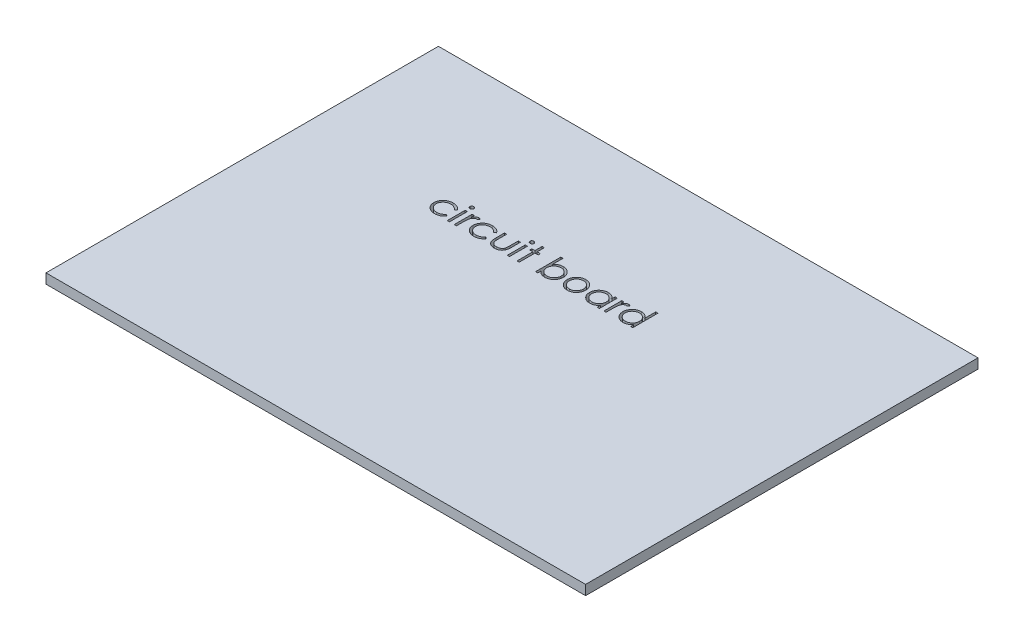
from build123d import *

# Parameters (mm, degrees)
SKETCH1_W           = 69.85
SKETCH1_H           = 50.8
BOSS_EXTRUDE1_DEPTH = 1.27
SKETCH2_W           = 0.284935898
SKETCH2_H           = 2.320192307
SKETCH2_W_2         = 0.284935897
CUT_EXTRUDE1_DEPTH  = 87.378674452


with BuildPart() as part:
    # Sketch1 → Boss-Extrude1 (new body)
    with BuildSketch(Plane(origin=(0, 0, 0), x_dir=(1, 0, 0), z_dir=(0, 1, 0))):
        with Locations((34.925, 25.4)):
            Rectangle(SKETCH1_W, SKETCH1_H)
    extrude(amount=BOSS_EXTRUDE1_DEPTH)

    # Sketch2 → Cut-Extrude1 (cut, through all)
    # profile 1 of 14: a face of its own
    with BuildSketch(Plane(origin=(0, 1.27, 0), x_dir=(1, 0, 0), z_dir=(0, 1, 0))):
        with BuildLine():
            Line((19.584512115, 33.646399985), (19.346005504, 33.498207878))
            add(Edge.make_bspline(
                [(19.346005504, 33.498207878), (19.319852698, 33.53070935), (19.268375338, 33.594682978), (19.178986174, 33.677241989), (19.08372582, 33.748150663), (18.980966448, 33.805939065), (18.870852186, 33.850589953), (18.753817286, 33.882185925), (18.629878435, 33.901874774), (18.544910719, 33.904112547), (18.501374094, 33.90525916)],
                knots=[0, 0, 0, 0, 1.026593902, 2.0206758, 2.988051866, 3.946915611, 4.916868779, 5.907761954, 6.927957743, 8, 8, 8, 8], degree=3))
            add(Edge.make_bspline(
                [(18.501374094, 33.90525916), (18.46657704, 33.904300453), (18.398045189, 33.902412306), (18.297437464, 33.89060993), (18.201604758, 33.869163251), (18.109946401, 33.840904883), (18.023114307, 33.803031406), (17.940880973, 33.756939699), (17.862516993, 33.703372876), (17.790293235, 33.641314739), (17.724226921, 33.573824519), (17.666987192, 33.501476524), (17.617151546, 33.426437765), (17.578048285, 33.346834399), (17.546048666, 33.264487551), (17.524996856, 33.177842839), (17.510968168, 33.088010289), (17.509363134, 33.026761509), (17.508550576, 32.995753952)],
                knots=[0, 0, 0, 0, 1.112346261, 2.190735716, 3.231507886, 4.247384806, 5.251966152, 6.253067467, 7.256802811, 8.280671706, 9.291813951, 10.270744147, 11.225547591, 12.165006084, 13.100104208, 14.043489273, 15.009504848, 16, 16, 16, 16], degree=3))
            add(Edge.make_bspline(
                [(17.508550576, 32.995753952), (17.510164612, 32.955141882), (17.513370936, 32.874464954), (17.538500118, 32.755376962), (17.579633973, 32.640239043), (17.635929309, 32.529868661), (17.707119281, 32.427729677), (17.790732963, 32.336123258), (17.886816703, 32.256824433), (17.994523889, 32.191081499), (18.111325556, 32.138230116), (18.235958008, 32.100577035), (18.367402809, 32.077850954), (18.457397501, 32.074988063), (18.503282147, 32.073528391)],
                knots=[0, 0, 0, 0, 0.966302908, 1.919585723, 2.883856336, 3.870342332, 4.860282998, 5.839159637, 6.814385684, 7.815993281, 8.834850808, 9.858348828, 10.908058873, 12, 12, 12, 12], degree=3))
            add(Edge.make_bspline(
                [(18.503282147, 32.073528391), (18.545332921, 32.07470722), (18.627973852, 32.077023933), (18.748775603, 32.096553779), (18.863783094, 32.128524789), (18.972992236, 32.173108729), (19.076203472, 32.230737261), (19.172749938, 32.301820223), (19.264552739, 32.384312711), (19.318524996, 32.448101156), (19.346005504, 32.480579673)],
                knots=[0, 0, 0, 0, 1.039848629, 2.043578496, 3.018386758, 3.987534228, 4.954977003, 5.934852016, 6.948509513, 8, 8, 8, 8], degree=3))
            Line((19.346005504, 32.480579673), (19.584512115, 32.324119336))
            add(Edge.make_bspline(
                [(19.584512115, 32.324119336), (19.570371842, 32.303354177), (19.54213823, 32.26189278), (19.494941741, 32.20343276), (19.444033037, 32.148712377), (19.389610727, 32.09780498), (19.332385426, 32.049492349), (19.27040225, 32.006084134), (19.205659817, 31.965140402), (19.137398081, 31.928298726), (19.066322805, 31.895182277), (18.992534, 31.866706), (18.916352313, 31.842240261), (18.837688172, 31.822793525), (18.756386493, 31.807271551), (18.672657539, 31.796972121), (18.586530147, 31.789283831), (18.528316838, 31.788824937), (18.498830023, 31.788592493)],
                knots=[0, 0, 0, 0, 0.954134338, 1.905101784, 2.851144739, 3.791306361, 4.734911809, 5.6936923, 6.663572882, 7.643865596, 8.638447847, 9.640600242, 10.646758161, 11.676244097, 12.717260333, 13.78922464, 14.880174919, 16, 16, 16, 16], degree=3))
            add(Edge.make_bspline(
                [(18.498830023, 31.788592493), (18.453825865, 31.789401012), (18.365617387, 31.790985713), (18.236510541, 31.808410544), (18.113126714, 31.834679239), (17.995508061, 31.872383483), (17.88363627, 31.920919958), (17.777615655, 31.980208016), (17.677797267, 32.050739997), (17.5851682, 32.131260509), (17.500095031, 32.218564519), (17.427046273, 32.312771231), (17.363686634, 32.410417038), (17.31280722, 32.513658537), (17.27230608, 32.621123553), (17.244633839, 32.733672985), (17.226736148, 32.850378959), (17.224664797, 32.929965216), (17.223614679, 32.970313247)],
                knots=[0, 0, 0, 0, 1.1129367, 2.181364009, 3.217532258, 4.231199276, 5.232079859, 6.230262199, 7.231623845, 8.250719726, 9.263571943, 10.242672461, 11.195837495, 12.138959767, 13.085126421, 14.0317438, 15.002148558, 16, 16, 16, 16], degree=3))
            add(Edge.make_bspline(
                [(17.223614679, 32.970313247), (17.224014744, 32.997689398), (17.224810538, 33.052145082), (17.233938144, 33.132967035), (17.245729616, 33.212712644), (17.265710106, 33.290371075), (17.288788393, 33.36712016), (17.31824834, 33.44203483), (17.352806305, 33.515463212), (17.392042, 33.587216152), (17.436209648, 33.656113234), (17.485087624, 33.721204059), (17.536834986, 33.78327056), (17.593872602, 33.840169972), (17.653780002, 33.894177802), (17.718252074, 33.943851244), (17.786919025, 33.989336286), (17.858749611, 34.031473993), (17.933702027, 34.068992909), (18.011323221, 34.101317346), (18.091145469, 34.128942183), (18.173296457, 34.150812416), (18.257230914, 34.169152508), (18.343610271, 34.180689411), (18.432104072, 34.188841244), (18.492026322, 34.189740034), (18.522362676, 34.190195058)],
                knots=[0, 0, 0, 0, 0.990994727, 1.971252077, 2.943264845, 3.907940874, 4.872158414, 5.844625996, 6.82015047, 7.809835459, 8.804511986, 9.781214284, 10.756496977, 11.728388426, 12.696359165, 13.676225489, 14.672885716, 15.677705647, 16.690706858, 17.706033469, 18.721040654, 19.747369689, 20.783475414, 21.830280724, 22.901553713, 24, 24, 24, 24], degree=3))
            add(Edge.make_bspline(
                [(18.522362676, 34.190195058), (18.560353917, 34.189358771), (18.6361465, 34.187690377), (18.748578427, 34.173649028), (18.859354353, 34.152479565), (18.966530654, 34.121117069), (19.068807849, 34.083140753), (19.164543579, 34.040493505), (19.251484245, 33.9909684), (19.331247129, 33.936793725), (19.403981405, 33.875687761), (19.470433695, 33.806920021), (19.531966691, 33.7308484), (19.566852422, 33.674781773), (19.584512115, 33.646399985)],
                knots=[0, 0, 0, 0, 1.095225653, 2.184976855, 3.262915854, 4.344593502, 5.400796181, 6.407717688, 7.363229445, 8.282371371, 9.184954523, 10.097238608, 11.036792983, 12, 12, 12, 12], degree=3))
        make_face()
    # profile 2 of 14: a face of its own
    with BuildSketch(Plane(origin=(0, 1.27, 0), x_dir=(1, 0, 0), z_dir=(0, 1, 0))):
        with BuildLine():
            add(Edge.make_bspline(
                [(20.254874695, 35.126413006), (20.272556103, 35.125592811), (20.307179695, 35.123986711), (20.357247874, 35.110233085), (20.402838163, 35.086919799), (20.443276535, 35.055641803), (20.477976461, 35.018857665), (20.502270391, 34.975985215), (20.517884493, 34.929667736), (20.51977004, 34.897359762), (20.520730063, 34.880910202)],
                knots=[0, 0, 0, 0, 1.055194115, 2.066272739, 3.074728998, 4.095836921, 5.109056067, 6.073838105, 7.019297344, 8, 8, 8, 8], degree=3))
            add(Edge.make_bspline(
                [(20.520730063, 34.880910202), (20.51974839, 34.864887652), (20.517807737, 34.833212968), (20.502282452, 34.787698461), (20.477769422, 34.745421718), (20.443298786, 34.708709002), (20.402832267, 34.677448297), (20.35724944, 34.654130427), (20.307179283, 34.640378016), (20.272555964, 34.638771749), (20.254874695, 34.637951468)],
                knots=[0, 0, 0, 0, 0.96129708, 1.900370562, 2.859976407, 3.87933698, 4.906634145, 5.921202961, 6.938410037, 8, 8, 8, 8], degree=3))
            add(Edge.make_bspline(
                [(20.254874695, 34.637951468), (20.237395617, 34.638740428), (20.203374875, 34.640276037), (20.154056382, 34.654400267), (20.108854824, 34.677456276), (20.068337585, 34.708504316), (20.034564481, 34.745647187), (20.009982429, 34.78767266), (19.994492999, 34.833219536), (19.992547515, 34.864889859), (19.991563397, 34.880910202)],
                knots=[0, 0, 0, 0, 1.054934014, 2.053291228, 3.073705704, 4.106921865, 5.123545215, 6.088680038, 7.033164197, 8, 8, 8, 8], degree=3))
            add(Edge.make_bspline(
                [(19.991563397, 34.880910202), (19.992525954, 34.897357472), (19.994416477, 34.92966095), (20.009994039, 34.976011444), (20.034359722, 35.018630378), (20.068359948, 35.055846367), (20.108848872, 35.086911868), (20.15405792, 35.109963259), (20.203374468, 35.124088688), (20.237395479, 35.125624131), (20.254874695, 35.126413006)],
                knots=[0, 0, 0, 0, 0.98631895, 1.937192651, 2.907499808, 3.917963147, 4.944918757, 5.95915025, 6.951458133, 8, 8, 8, 8], degree=3))
        make_face()
    # profile 3 of 14: a face of its own
    with BuildSketch(Plane(origin=(0, 1.27, 0), x_dir=(1, 0, 0), z_dir=(0, 1, 0))):
        with Locations((20.25614673, 32.989393776)):
            Rectangle(SKETCH2_W, SKETCH2_H)
    # profile 4 of 14: a face of its own
    with BuildSketch(Plane(origin=(0, 1.27, 0), x_dir=(1, 0, 0), z_dir=(0, 1, 0))):
        with BuildLine():
            Line((21.009191602, 34.149489929), (21.294127499, 34.149489929))
            Line((21.294127499, 34.149489929), (21.294127499, 33.807948463))
            add(Edge.make_bspline(
                [(21.294127499, 33.807948463), (21.315163016, 33.839749107), (21.355393279, 33.900567592), (21.422261436, 33.981003315), (21.490753744, 34.047601251), (21.561198092, 34.1006723), (21.634112512, 34.140417057), (21.707896746, 34.169530025), (21.783711637, 34.186745161), (21.834658525, 34.189043552), (21.860183188, 34.190195058)],
                knots=[0, 0, 0, 0, 1.2804753, 2.448899062, 3.506932113, 4.484331642, 5.4025378, 6.288909075, 7.142734305, 8, 8, 8, 8], degree=3))
            add(Edge.make_bspline(
                [(21.860183188, 34.190195058), (21.879982785, 34.18911508), (21.920721741, 34.186892956), (21.982391661, 34.171280279), (22.045931078, 34.146353787), (22.086881673, 34.122913014), (22.108230063, 34.110692854)],
                knots=[0, 0, 0, 0, 0.901110191, 1.854092781, 2.881294221, 4, 4, 4, 4], degree=3))
            Line((22.108230063, 34.110692854), (21.951769727, 33.863918014))
            add(Edge.make_bspline(
                [(21.951769727, 33.863918014), (21.938063686, 33.870032399), (21.912046997, 33.88163867), (21.873988212, 33.895374637), (21.838898714, 33.903462646), (21.816543486, 33.90468794), (21.80612169, 33.90525916)],
                knots=[0, 0, 0, 0, 1.180555205, 2.24091978, 3.179933427, 4, 4, 4, 4], degree=3))
            add(Edge.make_bspline(
                [(21.80612169, 33.90525916), (21.783256489, 33.903735126), (21.736618107, 33.900626539), (21.668142882, 33.876189192), (21.601697203, 33.836705581), (21.548927195, 33.792916787), (21.508067437, 33.750691285), (21.478911661, 33.713817377), (21.452166598, 33.672471047), (21.426612183, 33.627359119), (21.403329188, 33.57771133), (21.381598881, 33.524023701), (21.361951198, 33.466234049), (21.350747762, 33.425972762), (21.34500891, 33.405349304)],
                knots=[0, 0, 0, 0, 1.125678352, 2.296057538, 3.5422874, 4.923748041, 5.663163013, 6.437101912, 7.23742474, 8.08941207, 8.991984279, 9.93940061, 10.944477711, 12, 12, 12, 12], degree=3))
            add(Edge.make_bspline(
                [(21.34500891, 33.405349304), (21.340715953, 33.386955011), (21.33120738, 33.34621305), (21.321962199, 33.277861174), (21.312827708, 33.197103997), (21.306390061, 33.103716731), (21.300422837, 32.997932585), (21.297057262, 32.879590406), (21.294242271, 32.748568723), (21.294166917, 32.65697056), (21.294127499, 32.609055234)],
                knots=[0, 0, 0, 0, 0.566838948, 1.255505196, 2.06880316, 3.007127437, 4.065329342, 5.249902469, 6.561414163, 8, 8, 8, 8], degree=3))
            Line((21.294127499, 32.609055234), (21.294127499, 31.829297622))
            Line((21.294127499, 31.829297622), (21.009191602, 31.829297622))
            Line((21.009191602, 31.829297622), (21.009191602, 34.149489929))
        make_face()
    # profile 5 of 14: a face of its own
    with BuildSketch(Plane(origin=(0, 1.27, 0), x_dir=(1, 0, 0), z_dir=(0, 1, 0))):
        with BuildLine():
            Line((24.67265314, 33.646399985), (24.43414653, 33.498207878))
            add(Edge.make_bspline(
                [(24.43414653, 33.498207878), (24.407993723, 33.53070935), (24.356516364, 33.594682978), (24.2671272, 33.677241989), (24.171866845, 33.748150663), (24.069107474, 33.805939065), (23.958993212, 33.850589953), (23.841958311, 33.882185925), (23.71801946, 33.901874774), (23.633051744, 33.904112547), (23.58951512, 33.90525916)],
                knots=[0, 0, 0, 0, 1.026593902, 2.0206758, 2.988051866, 3.946915611, 4.916868779, 5.907761954, 6.927957743, 8, 8, 8, 8], degree=3))
            add(Edge.make_bspline(
                [(23.58951512, 33.90525916), (23.554718066, 33.904300453), (23.486186215, 33.902412306), (23.38557849, 33.89060993), (23.289745784, 33.869163251), (23.198087426, 33.840904883), (23.111255332, 33.803031406), (23.029021999, 33.756939699), (22.950658019, 33.703372876), (22.878434261, 33.641314739), (22.812367947, 33.573824519), (22.755128218, 33.501476524), (22.705292571, 33.426437765), (22.666189311, 33.346834399), (22.634189692, 33.264487551), (22.613137882, 33.177842839), (22.599109194, 33.088010289), (22.59750416, 33.026761509), (22.596691602, 32.995753952)],
                knots=[0, 0, 0, 0, 1.112346261, 2.190735716, 3.231507886, 4.247384806, 5.251966152, 6.253067467, 7.256802811, 8.280671706, 9.291813951, 10.270744147, 11.225547591, 12.165006084, 13.100104208, 14.043489273, 15.009504848, 16, 16, 16, 16], degree=3))
            add(Edge.make_bspline(
                [(22.596691602, 32.995753952), (22.598305638, 32.955141882), (22.601511962, 32.874464954), (22.626641143, 32.755376962), (22.667774999, 32.640239043), (22.724070334, 32.529868661), (22.795260306, 32.427729677), (22.878873989, 32.336123258), (22.974957729, 32.256824433), (23.082664914, 32.191081499), (23.199466582, 32.138230116), (23.324099034, 32.100577035), (23.455543835, 32.077850954), (23.545538527, 32.074988063), (23.591423172, 32.073528391)],
                knots=[0, 0, 0, 0, 0.966302908, 1.919585723, 2.883856336, 3.870342332, 4.860282998, 5.839159637, 6.814385684, 7.815993281, 8.834850808, 9.858348828, 10.908058873, 12, 12, 12, 12], degree=3))
            add(Edge.make_bspline(
                [(23.591423172, 32.073528391), (23.633473947, 32.07470722), (23.716114877, 32.077023933), (23.836916629, 32.096553779), (23.951924119, 32.128524789), (24.061133261, 32.173108729), (24.164344498, 32.230737261), (24.260890964, 32.301820223), (24.352693765, 32.384312711), (24.406666022, 32.448101156), (24.43414653, 32.480579673)],
                knots=[0, 0, 0, 0, 1.039848629, 2.043578496, 3.018386758, 3.987534228, 4.954977003, 5.934852016, 6.948509513, 8, 8, 8, 8], degree=3))
            Line((24.43414653, 32.480579673), (24.67265314, 32.324119336))
            add(Edge.make_bspline(
                [(24.67265314, 32.324119336), (24.658512868, 32.303354177), (24.630279256, 32.26189278), (24.583082767, 32.20343276), (24.532174062, 32.148712377), (24.477751753, 32.09780498), (24.420526451, 32.049492349), (24.358543276, 32.006084134), (24.293800843, 31.965140402), (24.225539107, 31.928298726), (24.154463831, 31.895182277), (24.080675026, 31.866706), (24.004493339, 31.842240261), (23.925829197, 31.822793525), (23.844527518, 31.807271551), (23.760798564, 31.796972121), (23.674671172, 31.789283831), (23.616457864, 31.788824937), (23.586971049, 31.788592493)],
                knots=[0, 0, 0, 0, 0.954134338, 1.905101784, 2.851144739, 3.791306361, 4.734911809, 5.6936923, 6.663572882, 7.643865596, 8.638447847, 9.640600242, 10.646758161, 11.676244097, 12.717260333, 13.78922464, 14.880174919, 16, 16, 16, 16], degree=3))
            add(Edge.make_bspline(
                [(23.586971049, 31.788592493), (23.54196689, 31.789401012), (23.453758412, 31.790985713), (23.324651566, 31.808410544), (23.20126774, 31.834679239), (23.083649086, 31.872383483), (22.971777295, 31.920919958), (22.865756681, 31.980208016), (22.765938293, 32.050739997), (22.673309226, 32.131260509), (22.588236057, 32.218564519), (22.515187298, 32.312771231), (22.45182766, 32.410417038), (22.400948246, 32.513658537), (22.360447105, 32.621123553), (22.332774864, 32.733672985), (22.314877174, 32.850378959), (22.312805822, 32.929965216), (22.311755705, 32.970313247)],
                knots=[0, 0, 0, 0, 1.1129367, 2.181364009, 3.217532258, 4.231199276, 5.232079859, 6.230262199, 7.231623845, 8.250719726, 9.263571943, 10.242672461, 11.195837495, 12.138959767, 13.085126421, 14.0317438, 15.002148558, 16, 16, 16, 16], degree=3))
            add(Edge.make_bspline(
                [(22.311755705, 32.970313247), (22.312155769, 32.997689398), (22.312951564, 33.052145082), (22.32207917, 33.132967035), (22.333870642, 33.212712644), (22.353851132, 33.290371075), (22.376929419, 33.36712016), (22.406389366, 33.44203483), (22.440947331, 33.515463212), (22.480183026, 33.587216152), (22.524350673, 33.656113234), (22.573228649, 33.721204059), (22.624976011, 33.78327056), (22.682013627, 33.840169972), (22.741921028, 33.894177802), (22.8063931, 33.943851244), (22.875060051, 33.989336286), (22.946890636, 34.031473993), (23.021843053, 34.068992909), (23.099464247, 34.101317346), (23.179286495, 34.128942183), (23.261437483, 34.150812416), (23.34537194, 34.169152508), (23.431751296, 34.180689411), (23.520245098, 34.188841244), (23.580167347, 34.189740034), (23.610503701, 34.190195058)],
                knots=[0, 0, 0, 0, 0.990994727, 1.971252077, 2.943264845, 3.907940874, 4.872158414, 5.844625996, 6.82015047, 7.809835459, 8.804511986, 9.781214284, 10.756496977, 11.728388426, 12.696359165, 13.676225489, 14.672885716, 15.677705647, 16.690706858, 17.706033469, 18.721040654, 19.747369689, 20.783475414, 21.830280724, 22.901553713, 24, 24, 24, 24], degree=3))
            add(Edge.make_bspline(
                [(23.610503701, 34.190195058), (23.648494942, 34.189358771), (23.724287526, 34.187690377), (23.836719453, 34.173649028), (23.947495378, 34.152479565), (24.05467168, 34.121117069), (24.156948875, 34.083140753), (24.252684605, 34.040493505), (24.33962527, 33.9909684), (24.419388155, 33.936793725), (24.492122431, 33.875687761), (24.558574721, 33.806920021), (24.620107717, 33.7308484), (24.654993448, 33.674781773), (24.67265314, 33.646399985)],
                knots=[0, 0, 0, 0, 1.095225653, 2.184976855, 3.262915854, 4.344593502, 5.400796181, 6.407717688, 7.363229445, 8.282371371, 9.184954523, 10.097238608, 11.036792983, 12, 12, 12, 12], degree=3))
        make_face()
    # profile 6 of 14: a face of its own
    with BuildSketch(Plane(origin=(0, 1.27, 0), x_dir=(1, 0, 0), z_dir=(0, 1, 0))):
        with BuildLine():
            Line((25.201819807, 34.149489929), (25.486755705, 34.149489929))
            Line((25.486755705, 34.149489929), (25.486755705, 33.073348102))
            add(Edge.make_bspline(
                [(25.486755705, 33.073348102), (25.486884433, 33.041758894), (25.487130683, 32.981330219), (25.48880068, 32.894375871), (25.492728693, 32.815076424), (25.497639805, 32.74338607), (25.503955457, 32.679316936), (25.511469649, 32.623092805), (25.51986836, 32.574076081), (25.528089536, 32.544554609), (25.531912956, 32.530825066)],
                knots=[0, 0, 0, 0, 1.388932606, 2.656963016, 3.823490214, 4.879454478, 5.816252168, 6.653371382, 7.373723809, 8, 8, 8, 8], degree=3))
            add(Edge.make_bspline(
                [(25.531912956, 32.530825066), (25.538046562, 32.513568604), (25.550186257, 32.479414439), (25.572205774, 32.430075841), (25.599445765, 32.384378263), (25.629254323, 32.340559569), (25.6636345, 32.299917767), (25.702151306, 32.262521488), (25.743515421, 32.226957777), (25.804978907, 32.184880144), (25.889034098, 32.139781238), (25.999390526, 32.100868602), (26.119046502, 32.077613251), (26.201745926, 32.074915177), (26.2442527, 32.073528391)],
                knots=[0, 0, 0, 0, 0.725840625, 1.436591201, 2.137033971, 2.831655856, 3.53531722, 4.242432219, 4.957935707, 5.694543706, 7.190802206, 8.724350549, 10.316345118, 12, 12, 12, 12], degree=3))
            add(Edge.make_bspline(
                [(26.2442527, 32.073528391), (26.286755525, 32.074944666), (26.368990627, 32.077684897), (26.48733192, 32.100167108), (26.595509989, 32.137727983), (26.692439066, 32.190167563), (26.777679507, 32.25434072), (26.848712801, 32.329641568), (26.907320811, 32.413687798), (26.932910785, 32.476393393), (26.945780144, 32.507928431)],
                knots=[0, 0, 0, 0, 1.157059328, 2.238695713, 3.266970494, 4.264342957, 5.228770407, 6.160125903, 7.074715775, 8, 8, 8, 8], degree=3))
            add(Edge.make_bspline(
                [(26.945780144, 32.507928431), (26.949584909, 32.520597859), (26.957996318, 32.54860687), (26.967033594, 32.596122785), (26.975174712, 32.652787105), (26.982126308, 32.718970623), (26.987083991, 32.794500382), (26.989756458, 32.87935278), (26.992775679, 32.973261442), (26.992821505, 33.039000053), (26.992845448, 33.073348102)],
                knots=[0, 0, 0, 0, 0.557542046, 1.232589297, 2.036731608, 2.971723315, 4.038036528, 5.22795436, 6.551621927, 8, 8, 8, 8], degree=3))
            Line((26.992845448, 33.073348102), (26.992845448, 34.149489929))
            Line((26.992845448, 34.149489929), (27.277781346, 34.149489929))
            Line((27.277781346, 34.149489929), (27.277781346, 33.019922622))
            add(Edge.make_bspline(
                [(27.277781346, 33.019922622), (27.277380665, 32.981543973), (27.276603291, 32.907084146), (27.271607343, 32.798876416), (27.263035195, 32.698036379), (27.25002433, 32.604510658), (27.234724754, 32.518370657), (27.214988707, 32.439505974), (27.191422734, 32.368159593), (27.164838445, 32.303079553), (27.133431465, 32.244072727), (27.100024097, 32.188069522), (27.061448054, 32.136459502), (27.020835056, 32.086673563), (26.975657839, 32.041188035), (26.926762967, 31.998959196), (26.874838636, 31.959341517), (26.818732578, 31.923880143), (26.759263864, 31.891933614), (26.696359079, 31.863616172), (26.629247745, 31.841207406), (26.558795732, 31.821875587), (26.484657868, 31.806713176), (26.406905625, 31.796021076), (26.325565195, 31.789466669), (26.270130185, 31.788888778), (26.241708629, 31.788592493)],
                knots=[0, 0, 0, 0, 1.493040784, 2.896703357, 4.213163133, 5.428574705, 6.569057535, 7.615249723, 8.588095153, 9.490268104, 10.346124644, 11.18633936, 12.024365274, 12.850166724, 13.684164916, 14.514361689, 15.362232829, 16.222528818, 17.093394965, 17.986930858, 18.902426812, 19.842810585, 20.827885679, 21.843828298, 22.894529745, 24, 24, 24, 24], degree=3))
            add(Edge.make_bspline(
                [(26.241708629, 31.788592493), (26.213499649, 31.788900656), (26.158066376, 31.789506225), (26.076721747, 31.795984865), (25.998754083, 31.806696563), (25.924440578, 31.821986653), (25.853706661, 31.841072095), (25.786265814, 31.863753873), (25.722907725, 31.89194831), (25.662871193, 31.923677952), (25.606626169, 31.959569309), (25.553913388, 31.998910316), (25.504803529, 32.041642245), (25.45928576, 32.087586633), (25.417998988, 32.137313425), (25.380428722, 32.190422612), (25.345996568, 32.246387964), (25.314833679, 32.30631669), (25.288062301, 32.37214987), (25.264426471, 32.444990808), (25.245094678, 32.525638091), (25.229362581, 32.614022769), (25.216706632, 32.709721843), (25.207919917, 32.813288905), (25.203006985, 32.924471683), (25.202224065, 33.001261226), (25.201819807, 33.040911203)],
                knots=[0, 0, 0, 0, 1.083640291, 2.129454052, 3.13281866, 4.105697902, 5.042300162, 5.946461698, 6.836384745, 7.703652036, 8.553297018, 9.397182691, 10.228592656, 11.052265423, 11.879314572, 12.708807002, 13.549817954, 14.402308542, 15.300838682, 16.27712199, 17.341985831, 18.484375296, 19.725102775, 21.0496083, 22.476576903, 24, 24, 24, 24], degree=3))
            Line((25.201819807, 33.040911203), (25.201819807, 34.149489929))
        make_face()
    # profile 7 of 14: a face of its own
    with BuildSketch(Plane(origin=(0, 1.27, 0), x_dir=(1, 0, 0), z_dir=(0, 1, 0))):
        with BuildLine():
            add(Edge.make_bspline(
                [(28.029554182, 35.126413006), (28.04723559, 35.125592811), (28.081859183, 35.123986711), (28.131927361, 35.110233085), (28.177517651, 35.086919799), (28.217956023, 35.055641803), (28.252655948, 35.018857665), (28.276949878, 34.975985215), (28.292563981, 34.929667736), (28.294449527, 34.897359762), (28.295409551, 34.880910202)],
                knots=[0, 0, 0, 0, 1.055194115, 2.066272739, 3.074728998, 4.095836921, 5.109056067, 6.073838105, 7.019297344, 8, 8, 8, 8], degree=3))
            add(Edge.make_bspline(
                [(28.295409551, 34.880910202), (28.294427877, 34.864887652), (28.292487225, 34.833212968), (28.276961939, 34.787698461), (28.252448909, 34.745421718), (28.217978273, 34.708709002), (28.177511755, 34.677448297), (28.131928927, 34.654130427), (28.081858771, 34.640378016), (28.047235451, 34.638771749), (28.029554182, 34.637951468)],
                knots=[0, 0, 0, 0, 0.96129708, 1.900370562, 2.859976407, 3.87933698, 4.906634145, 5.921202961, 6.938410037, 8, 8, 8, 8], degree=3))
            add(Edge.make_bspline(
                [(28.029554182, 34.637951468), (28.012075104, 34.638740428), (27.978054362, 34.640276037), (27.928735869, 34.654400267), (27.883534311, 34.677456276), (27.843017072, 34.708504316), (27.809243968, 34.745647187), (27.784661916, 34.78767266), (27.769172486, 34.833219536), (27.767227002, 34.864889859), (27.766242884, 34.880910202)],
                knots=[0, 0, 0, 0, 1.054934014, 2.053291228, 3.073705704, 4.106921865, 5.123545215, 6.088680038, 7.033164197, 8, 8, 8, 8], degree=3))
            add(Edge.make_bspline(
                [(27.766242884, 34.880910202), (27.767205441, 34.897357472), (27.769095964, 34.92966095), (27.784673527, 34.976011444), (27.809039209, 35.018630378), (27.843039435, 35.055846367), (27.88352836, 35.086911868), (27.928737407, 35.109963259), (27.978053956, 35.124088688), (28.012074966, 35.125624131), (28.029554182, 35.126413006)],
                knots=[0, 0, 0, 0, 0.98631895, 1.937192651, 2.907499808, 3.917963147, 4.944918757, 5.95915025, 6.951458133, 8, 8, 8, 8], degree=3))
        make_face()
    # profile 8 of 14: a face of its own
    with BuildSketch(Plane(origin=(0, 1.27, 0), x_dir=(1, 0, 0), z_dir=(0, 1, 0))):
        with Locations((28.030826217, 32.989393776)):
            Rectangle(SKETCH2_W_2, SKETCH2_H)
    # profile 9 of 14: a face of its own
    with BuildSketch(Plane(origin=(0, 1.27, 0), x_dir=(1, 0, 0), z_dir=(0, 1, 0))):
        Polygon((29.150217243, 35.085707878), (29.43515314, 35.085707878), (29.43515314, 34.149489929), (29.842204422, 34.149489929), (29.842204422, 33.864554032), (29.43515314, 33.864554032), (29.43515314, 31.829297622), (29.150217243, 31.829297622), (29.150217243, 33.864554032), (28.743165961, 33.864554032), (28.743165961, 34.149489929), (29.150217243, 34.149489929), align=None)
    # profile 10 of 14: a face of its own
    with BuildSketch(Plane(origin=(0, 1.27, 0), x_dir=(1, 0, 0), z_dir=(0, 1, 0))):
        with BuildLine():
            Line((31.551819807, 31.829297622), (31.551819807, 35.085707878))
            Line((31.551819807, 35.085707878), (31.836755705, 35.085707878))
            Line((31.836755705, 35.085707878), (31.836755705, 33.728446259))
            add(Edge.make_bspline(
                [(31.836755705, 33.728446259), (31.868862592, 33.765419526), (31.931504452, 33.837555894), (32.036530233, 33.931760548), (32.146662428, 34.011636724), (32.262738846, 34.077482703), (32.384924578, 34.12762376), (32.512588705, 34.164292642), (32.646057578, 34.186415047), (32.7370614, 34.188924271), (32.783149935, 34.190195058)],
                knots=[0, 0, 0, 0, 1.077089805, 2.101446609, 3.097517232, 4.067117542, 5.031729543, 5.997785507, 6.985986182, 8, 8, 8, 8], degree=3))
            add(Edge.make_bspline(
                [(32.783149935, 34.190195058), (32.824122075, 34.189069993), (32.905130977, 34.18684555), (33.024222639, 34.1699414), (33.138806824, 34.142529537), (33.248821162, 34.104527346), (33.353752311, 34.054105645), (33.454498741, 33.993743173), (33.550544291, 33.921862689), (33.640401223, 33.839677078), (33.72321782, 33.750453571), (33.795709882, 33.655039999), (33.85694175, 33.55482331), (33.907588708, 33.450138967), (33.94675102, 33.34055942), (33.973731506, 33.226192112), (33.990870577, 33.107149552), (33.9930298, 33.02613008), (33.994127499, 32.984941652)],
                knots=[0, 0, 0, 0, 1.034377878, 2.045141349, 3.03070803, 4.00595497, 4.978199603, 5.965204761, 6.967410914, 8.002051993, 9.036360596, 10.037508045, 11.022711142, 11.997267194, 12.969246472, 13.954813154, 14.960274251, 16, 16, 16, 16], degree=3))
            add(Edge.make_bspline(
                [(33.994127499, 32.984941652), (33.993005871, 32.94439235), (33.990794197, 32.864435513), (33.97390201, 32.746773137), (33.946010756, 32.633526603), (33.906131683, 32.524988541), (33.855998488, 32.420649048), (33.793304688, 32.321697539), (33.72090471, 32.226412182), (33.637147168, 32.137853602), (33.546511302, 32.055999018), (33.449524811, 31.984873697), (33.348630639, 31.923444596), (33.242256244, 31.87477144), (33.131976664, 31.835400604), (33.01661042, 31.808079556), (32.896810206, 31.792138284), (32.815422357, 31.789783734), (32.774245688, 31.788592493)],
                knots=[0, 0, 0, 0, 1.024244038, 2.01964794, 2.996620209, 3.965911562, 4.936179293, 5.91563013, 6.920572822, 7.955171681, 8.990768464, 10.002129126, 10.989675881, 11.969873457, 12.952483066, 13.943799762, 14.959703725, 16, 16, 16, 16], degree=3))
            add(Edge.make_bspline(
                [(32.774245688, 31.788592493), (32.727105908, 31.789899331), (32.634673018, 31.792461811), (32.499460958, 31.813706171), (32.371479838, 31.849866346), (32.249271776, 31.89845451), (32.13458377, 31.964248361), (32.02668767, 32.045851984), (31.926263896, 32.144610029), (31.867102928, 32.219958667), (31.836755705, 32.258609521)],
                knots=[0, 0, 0, 0, 1.035807596, 2.031038093, 2.998900396, 3.954262848, 4.914341711, 5.895762244, 6.92060972, 8, 8, 8, 8], degree=3))
            Line((31.836755705, 32.258609521), (31.836755705, 31.829297622))
            Line((31.836755705, 31.829297622), (31.551819807, 31.829297622))
        make_face()
        with BuildLine():
            add(Edge.make_bspline(
                [(32.771701618, 32.073528391), (32.813352495, 32.075010326), (32.895564701, 32.077935429), (33.016254425, 32.100771502), (33.131746601, 32.138766376), (33.241459254, 32.190730883), (33.343675487, 32.256065158), (33.434981805, 32.335119184), (33.516152685, 32.425381272), (33.58387251, 32.527193265), (33.640411317, 32.635552359), (33.679249075, 32.749538761), (33.705301965, 32.866101891), (33.707889407, 32.945155802), (33.709191602, 32.984941652)],
                knots=[0, 0, 0, 0, 1.031910345, 2.036826888, 3.032245421, 4.038315463, 5.03827337, 6.029480047, 7.023177075, 8.037597977, 9.052889626, 10.043399556, 11.015292101, 12, 12, 12, 12], degree=3))
            add(Edge.make_bspline(
                [(33.709191602, 32.984941652), (33.707479149, 33.024688608), (33.704061078, 33.10402384), (33.680135383, 33.221634609), (33.638354388, 33.335560526), (33.582911609, 33.445486273), (33.514088508, 33.548000492), (33.433347384, 33.640066535), (33.340926032, 33.71949595), (33.238579073, 33.785708371), (33.129558471, 33.839737394), (33.014813396, 33.876789668), (32.896741385, 33.901045023), (32.816554045, 33.903847304), (32.776153741, 33.90525916)],
                knots=[0, 0, 0, 0, 0.984795267, 1.965658976, 2.959410029, 3.983795688, 5.009594896, 6.01088574, 7.009236619, 8.019050059, 9.024672985, 10.014834719, 10.999826153, 12, 12, 12, 12], degree=3))
            add(Edge.make_bspline(
                [(32.776153741, 33.90525916), (32.734908217, 33.903848102), (32.65304422, 33.901047437), (32.532241618, 33.876747054), (32.414255639, 33.839511006), (32.301509092, 33.786051854), (32.196412913, 33.720636457), (32.102421472, 33.643764991), (32.021384988, 33.555971788), (31.954670282, 33.457541525), (31.901688785, 33.351237957), (31.863784957, 33.23783403), (31.841106706, 33.117926697), (31.838223686, 33.035709432), (31.836755705, 32.993845899)],
                knots=[0, 0, 0, 0, 1.016820015, 2.018181405, 3.029022337, 4.06341356, 5.088169224, 6.076823655, 7.05054209, 8.02560866, 9.001194327, 9.972267242, 10.967515442, 12, 12, 12, 12], degree=3))
            add(Edge.make_bspline(
                [(31.836755705, 32.993845899), (31.837626263, 32.961789449), (31.839339797, 32.898692212), (31.852430203, 32.806047807), (31.873254267, 32.71738993), (31.902594437, 32.63262197), (31.941149128, 32.552225129), (31.987604155, 32.475575113), (32.042896006, 32.403363568), (32.105404126, 32.335767527), (32.174312857, 32.274254701), (32.248265972, 32.220934454), (32.325752238, 32.175020153), (32.40765814, 32.138421618), (32.493030525, 32.108552559), (32.582745449, 32.088836947), (32.675883098, 32.075252448), (32.739425822, 32.074109127), (32.771701618, 32.073528391)],
                knots=[0, 0, 0, 0, 1.050331198, 2.067384183, 3.060053655, 4.031335885, 5.001026174, 5.976994447, 6.963687968, 7.976578778, 8.990422448, 9.985569286, 10.960374351, 11.936812464, 12.921228065, 13.919088064, 14.943024695, 16, 16, 16, 16], degree=3))
        make_face(mode=Mode.SUBTRACT)
    # profile 11 of 14: a face of its own
    with BuildSketch(Plane(origin=(0, 1.27, 0), x_dir=(1, 0, 0), z_dir=(0, 1, 0))):
        with BuildLine():
            add(Edge.make_bspline(
                [(35.684662355, 34.190195058), (35.728197296, 34.189268056), (35.813558674, 34.187450433), (35.938570114, 34.168024), (36.057900344, 34.138317463), (36.17200639, 34.097249688), (36.279426886, 34.04220249), (36.381726515, 33.976516919), (36.478624802, 33.898699852), (36.536702835, 33.838503604), (36.566182788, 33.807948463)],
                knots=[0, 0, 0, 0, 1.054011418, 2.066658804, 3.057071809, 4.030435133, 4.997543892, 5.974964718, 6.972108034, 8, 8, 8, 8], degree=3))
            add(Edge.make_bspline(
                [(36.566182788, 33.807948463), (36.591566418, 33.778725776), (36.641842434, 33.720845941), (36.706309193, 33.626996921), (36.761845894, 33.529805544), (36.806353009, 33.427981183), (36.841445852, 33.322412732), (36.866361162, 33.212737336), (36.881181096, 33.099197207), (36.883179501, 33.022086582), (36.884191602, 32.983033599)],
                knots=[0, 0, 0, 0, 1.025258237, 2.030674902, 3.01204498, 3.988269485, 4.97094183, 5.956517959, 6.965070386, 8, 8, 8, 8], degree=3))
            add(Edge.make_bspline(
                [(36.884191602, 32.983033599), (36.883301389, 32.943754261), (36.881542286, 32.866136457), (36.864902006, 32.75181889), (36.839020235, 32.640970729), (36.801979924, 32.534056057), (36.75448364, 32.430748064), (36.696525659, 32.331497973), (36.627699263, 32.236109966), (36.549681352, 32.145394013), (36.463455721, 32.061786089), (36.369914644, 31.988916873), (36.270896342, 31.926485919), (36.165084157, 31.876197171), (36.053444366, 31.836546228), (35.935736168, 31.808696928), (35.812142426, 31.791858829), (35.727753446, 31.789696587), (35.684662355, 31.788592493)],
                knots=[0, 0, 0, 0, 0.998656419, 1.973391657, 2.932242238, 3.890759089, 4.846373663, 5.82037756, 6.809684879, 7.83454468, 8.860553229, 9.859544525, 10.845671541, 11.83227036, 12.833544569, 13.85385346, 14.904124723, 16, 16, 16, 16], degree=3))
            add(Edge.make_bspline(
                [(35.684662355, 31.788592493), (35.641360145, 31.789700293), (35.55655058, 31.791869974), (35.432520582, 31.808631509), (35.314601428, 31.836533393), (35.202815485, 31.876327476), (35.096548373, 31.926487526), (34.996956337, 31.98872813), (34.903339271, 32.0618077), (34.817095399, 32.145388157), (34.739082379, 32.236111475), (34.670254721, 32.331497581), (34.612297068, 32.430748166), (34.564800697, 32.53405603), (34.52776041, 32.640970737), (34.501878633, 32.751818888), (34.485238354, 32.866136458), (34.483479251, 32.943754261), (34.482589038, 32.983033599)],
                knots=[0, 0, 0, 0, 1.099876186, 2.154163076, 3.173186993, 4.173200201, 5.163417411, 6.152872554, 7.150605724, 8.17532212, 9.198891216, 10.186952605, 11.159729845, 12.11414092, 13.071450619, 14.029093627, 15.002601286, 16, 16, 16, 16], degree=3))
            add(Edge.make_bspline(
                [(34.482589038, 32.983033599), (34.483608041, 33.021874323), (34.485625492, 33.098772281), (34.500430525, 33.212098972), (34.525248644, 33.321588746), (34.560383554, 33.426749713), (34.605300905, 33.528127859), (34.660057216, 33.625559384), (34.725181576, 33.718984032), (34.775257632, 33.776789062), (34.800597852, 33.80604041)],
                knots=[0, 0, 0, 0, 1.031353054, 2.041901799, 3.029428768, 4.008703097, 4.981709435, 5.96992636, 6.972712378, 8, 8, 8, 8], degree=3))
            add(Edge.make_bspline(
                [(34.800597852, 33.80604041), (34.83003336, 33.836860534), (34.887923465, 33.897473729), (34.985304096, 33.975063948), (35.087352062, 34.042116386), (35.195959674, 34.09606981), (35.309971981, 34.138559037), (35.429913722, 34.168100611), (35.555349368, 34.187380441), (35.641128453, 34.189247502), (35.684662355, 34.190195058)],
                knots=[0, 0, 0, 0, 1.027980169, 2.021703884, 2.998553061, 3.971491411, 4.943284454, 5.930300938, 6.949603206, 8, 8, 8, 8], degree=3))
        make_face()
        with BuildLine():
            add(Edge.make_bspline(
                [(35.68339032, 33.90525916), (35.652604058, 33.904384138), (35.591826277, 33.902656681), (35.502364225, 33.889517711), (35.416239943, 33.868701046), (35.333290034, 33.839124509), (35.253794228, 33.800934794), (35.177676413, 33.754027924), (35.104712699, 33.699025171), (35.036330399, 33.636012605), (34.973572159, 33.567179517), (34.918709994, 33.493838505), (34.872060076, 33.417179177), (34.833197932, 33.337121814), (34.804253554, 33.252855124), (34.783232313, 33.165333409), (34.770105737, 33.074378353), (34.768394522, 33.012546572), (34.767524935, 32.981125546)],
                knots=[0, 0, 0, 0, 1.021534396, 2.016698045, 2.994645724, 3.958388632, 4.93408049, 5.916473867, 6.921342795, 7.962252576, 8.998418191, 10.008913653, 10.997312074, 11.973003931, 12.956656626, 13.948281152, 14.957379055, 16, 16, 16, 16], degree=3))
            add(Edge.make_bspline(
                [(34.767524935, 32.981125546), (34.768982554, 32.940529065), (34.771875654, 32.85995264), (34.795402619, 32.741288264), (34.834760173, 32.627367584), (34.887907205, 32.518858434), (34.954497132, 32.418462867), (35.032953257, 32.328953735), (35.122433556, 32.251678035), (35.221871381, 32.18756041), (35.329235655, 32.136615489), (35.442861032, 32.100512133), (35.561370805, 32.077042812), (35.642361182, 32.074710117), (35.68339032, 32.073528391)],
                knots=[0, 0, 0, 0, 1.016792936, 2.018143844, 3.017858371, 4.030088057, 5.03801393, 6.028138512, 7.003788237, 7.991172063, 8.984598303, 9.972568034, 10.972917682, 12, 12, 12, 12], degree=3))
            add(Edge.make_bspline(
                [(35.68339032, 32.073528391), (35.724417097, 32.074717002), (35.805402817, 32.077063288), (35.923747927, 32.100393932), (36.037062744, 32.136773681), (36.144315503, 32.187503114), (36.243708065, 32.251921519), (36.333831911, 32.328517376), (36.411618151, 32.418699941), (36.478142207, 32.518991413), (36.532159609, 32.627199361), (36.571332942, 32.74130929), (36.594916466, 32.859947285), (36.597801932, 32.940527271), (36.599255705, 32.981125546)],
                knots=[0, 0, 0, 0, 1.02726834, 2.027799167, 3.010890988, 4.004497153, 4.992059811, 5.971914811, 6.958719428, 7.966827853, 8.981595046, 9.981490638, 10.983022906, 12, 12, 12, 12], degree=3))
            add(Edge.make_bspline(
                [(36.599255705, 32.981125546), (36.598386417, 33.012546759), (36.596675791, 33.07437891), (36.58354493, 33.165331278), (36.562539548, 33.252862941), (36.533536724, 33.337092973), (36.49484344, 33.417386459), (36.44729392, 33.493613425), (36.392655776, 33.567433578), (36.329140245, 33.635790095), (36.260829323, 33.699049735), (36.187836039, 33.754049253), (36.111831094, 33.800728643), (36.032566237, 33.839451161), (35.949605693, 33.868431963), (35.863602083, 33.889637907), (35.774521734, 33.902601157), (35.713961745, 33.904367492), (35.68339032, 33.90525916)],
                knots=[0, 0, 0, 0, 1.042956736, 2.052379634, 3.044323526, 4.02829302, 5.004299113, 5.996692471, 7.007513377, 8.048758398, 9.090003419, 10.095195979, 11.07790575, 12.047570684, 13.018257071, 13.989683339, 14.985167495, 16, 16, 16, 16], degree=3))
        make_face(mode=Mode.SUBTRACT)
    # profile 12 of 14: a face of its own
    with BuildSketch(Plane(origin=(0, 1.27, 0), x_dir=(1, 0, 0), z_dir=(0, 1, 0))):
        with BuildLine():
            Line((39.814960833, 34.149489929), (39.814960833, 31.829297622))
            Line((39.814960833, 31.829297622), (39.530024935, 31.829297622))
            Line((39.530024935, 31.829297622), (39.530024935, 32.230624745))
            add(Edge.make_bspline(
                [(39.530024935, 32.230624745), (39.497895032, 32.194303113), (39.435193123, 32.123420992), (39.330471537, 32.030817879), (39.219466119, 31.954274687), (39.102715634, 31.892452978), (38.980325514, 31.84601447), (38.852567063, 31.813007025), (38.719388168, 31.791785475), (38.62844496, 31.789666369), (38.582358669, 31.788592493)],
                knots=[0, 0, 0, 0, 1.074387032, 2.096679803, 3.090159297, 4.057316773, 5.018401886, 5.985159533, 6.978961417, 8, 8, 8, 8], degree=3))
            add(Edge.make_bspline(
                [(38.582358669, 31.788592493), (38.541384883, 31.789704988), (38.460582761, 31.791898877), (38.34172067, 31.808918967), (38.227336986, 31.836251745), (38.117323624, 31.874261838), (38.012392463, 31.924681583), (37.91164509, 31.985044001), (37.815603434, 32.056926754), (37.725731395, 32.139103037), (37.642970937, 32.228361347), (37.570343926, 32.32356195), (37.509789346, 32.424293183), (37.459152558, 32.529279687), (37.420148732, 32.639329649), (37.392958364, 32.754062509), (37.375958101, 32.873342609), (37.373765119, 32.954567747), (37.37265314, 32.995753952)],
                knots=[0, 0, 0, 0, 1.033919861, 2.038935746, 3.024066025, 3.998881131, 4.97069526, 5.957263378, 6.95902576, 7.993208707, 9.027059324, 10.027763471, 11.009749337, 11.988697705, 12.965288445, 13.950418724, 14.960734635, 16, 16, 16, 16], degree=3))
            add(Edge.make_bspline(
                [(37.37265314, 32.995753952), (37.373789764, 33.036088883), (37.376036809, 33.115828866), (37.392776515, 33.233103113), (37.420926073, 33.346058964), (37.460430192, 33.454332763), (37.511086823, 33.558055522), (37.572707302, 33.657300602), (37.645296079, 33.752341413), (37.728982191, 33.840943168), (37.819637304, 33.922786154), (37.916618796, 33.99391436), (38.017514201, 34.055343215), (38.123888503, 34.104014583), (38.234167234, 34.143392842), (38.349332146, 34.170637035), (38.468904078, 34.186691033), (38.550084738, 34.189015827), (38.591262916, 34.190195058)],
                knots=[0, 0, 0, 0, 1.020392517, 2.01726096, 2.990465484, 3.961182959, 4.928053699, 5.906110375, 6.912531644, 7.948652711, 8.985773172, 9.998621852, 10.987621588, 11.969261332, 12.953316658, 13.946091881, 14.958173133, 16, 16, 16, 16], degree=3))
            add(Edge.make_bspline(
                [(38.591262916, 34.190195058), (38.638615645, 34.188890812), (38.731472113, 34.186333247), (38.867296807, 34.165049201), (38.995788583, 34.129091449), (39.117939317, 34.080180576), (39.233310368, 34.015184943), (39.340809503, 33.933197407), (39.441561763, 33.834735044), (39.499963885, 33.759106141), (39.530024935, 33.72017803)],
                knots=[0, 0, 0, 0, 1.038897134, 2.037228247, 3.008116434, 3.962042015, 4.918381754, 5.904844433, 6.921570401, 8, 8, 8, 8], degree=3))
            Line((39.530024935, 33.72017803), (39.530024935, 34.149489929))
            Line((39.530024935, 34.149489929), (39.814960833, 34.149489929))
        make_face()
        with BuildLine():
            add(Edge.make_bspline(
                [(38.595079022, 33.90525916), (38.553428158, 33.903777217), (38.471215978, 33.900852098), (38.350526062, 33.878016142), (38.235034608, 33.840020831), (38.12531924, 33.788057964), (38.023113073, 33.72271761), (37.931769528, 33.643686069), (37.850541506, 33.553119635), (37.782226152, 33.451427006), (37.726536202, 33.342408309), (37.687377537, 33.228448997), (37.661551862, 33.111604482), (37.658913419, 33.032354046), (37.657589038, 32.992573864)],
                knots=[0, 0, 0, 0, 1.031046209, 2.035121221, 3.029706178, 4.034933723, 5.034054252, 6.02443088, 7.017295772, 8.038157696, 9.050218397, 10.03989886, 11.016116709, 12, 12, 12, 12], degree=3))
            add(Edge.make_bspline(
                [(37.657589038, 32.992573864), (37.659280762, 32.953031409), (37.662657581, 32.874101494), (37.686924282, 32.757097685), (37.727636739, 32.643111518), (37.783192039, 32.533110474), (37.852757762, 32.430980611), (37.933392469, 32.338687786), (38.025875938, 32.259322231), (38.12831732, 32.192885289), (38.237725978, 32.139216431), (38.352782473, 32.101873315), (38.471323945, 32.077763471), (38.551925705, 32.074947267), (38.592534951, 32.073528391)],
                knots=[0, 0, 0, 0, 0.979072187, 1.954306742, 2.945804271, 3.96968567, 4.997920485, 5.998718438, 6.996577872, 8.005894225, 9.015743152, 10.005417472, 10.995077863, 12, 12, 12, 12], degree=3))
            add(Edge.make_bspline(
                [(38.592534951, 32.073528391), (38.633761422, 32.075034215), (38.715756782, 32.078029151), (38.836804753, 32.10096287), (38.954275184, 32.138853137), (39.066567884, 32.191375916), (39.171176088, 32.256470089), (39.265063449, 32.332676522), (39.344452934, 32.421307267), (39.41175623, 32.51871305), (39.464529644, 32.625494647), (39.502970783, 32.739190662), (39.525698255, 32.859805055), (39.528562767, 32.942231618), (39.530024935, 32.984305634)],
                knots=[0, 0, 0, 0, 1.01762866, 2.023962475, 3.030623092, 4.058876274, 5.077231937, 6.066672613, 7.034107872, 8.005628644, 8.981990164, 9.965428785, 10.961468474, 12, 12, 12, 12], degree=3))
            add(Edge.make_bspline(
                [(39.530024935, 32.984305634), (39.52915439, 33.016362095), (39.527440881, 33.079459354), (39.514350293, 33.172103602), (39.493526895, 33.260762053), (39.464184298, 33.345527921), (39.425638633, 33.425932542), (39.379149588, 33.502553239), (39.323899645, 33.57499151), (39.260778199, 33.642249867), (39.191685479, 33.703596729), (39.118574718, 33.758355719), (39.040579711, 33.80333982), (38.959012114, 33.840570116), (38.873730403, 33.870196631), (38.784040627, 33.889961181), (38.690896117, 33.90353233), (38.627354338, 33.904677489), (38.595079022, 33.90525916)],
                knots=[0, 0, 0, 0, 1.050140795, 2.067009409, 3.05949893, 4.030605086, 5.00011959, 5.97591094, 6.962425594, 7.979863591, 8.993523472, 9.986985069, 10.967611495, 11.937549037, 12.921786183, 13.919465291, 14.943216303, 16, 16, 16, 16], degree=3))
        make_face(mode=Mode.SUBTRACT)
    # profile 13 of 14: a face of its own
    with BuildSketch(Plane(origin=(0, 1.27, 0), x_dir=(1, 0, 0), z_dir=(0, 1, 0))):
        with BuildLine():
            Line((40.384832628, 34.149489929), (40.669768525, 34.149489929))
            Line((40.669768525, 34.149489929), (40.669768525, 33.807948463))
            add(Edge.make_bspline(
                [(40.669768525, 33.807948463), (40.690804042, 33.839749107), (40.731034304, 33.900567592), (40.797902462, 33.981003315), (40.866394769, 34.047601251), (40.936839118, 34.1006723), (41.009753537, 34.140417057), (41.083537772, 34.169530025), (41.159352662, 34.186745161), (41.210299551, 34.189043552), (41.235824214, 34.190195058)],
                knots=[0, 0, 0, 0, 1.2804753, 2.448899062, 3.506932113, 4.484331642, 5.4025378, 6.288909075, 7.142734305, 8, 8, 8, 8], degree=3))
            add(Edge.make_bspline(
                [(41.235824214, 34.190195058), (41.25562381, 34.18911508), (41.296362766, 34.186892956), (41.358032687, 34.171280279), (41.421572104, 34.146353787), (41.462522698, 34.122913014), (41.483871089, 34.110692854)],
                knots=[0, 0, 0, 0, 0.901110191, 1.854092781, 2.881294221, 4, 4, 4, 4], degree=3))
            Line((41.483871089, 34.110692854), (41.327410753, 33.863918014))
            add(Edge.make_bspline(
                [(41.327410753, 33.863918014), (41.313704712, 33.870032399), (41.287688023, 33.88163867), (41.249629238, 33.895374637), (41.21453974, 33.903462646), (41.192184512, 33.90468794), (41.181762716, 33.90525916)],
                knots=[0, 0, 0, 0, 1.180555205, 2.24091978, 3.179933427, 4, 4, 4, 4], degree=3))
            add(Edge.make_bspline(
                [(41.181762716, 33.90525916), (41.158897515, 33.903735126), (41.112259132, 33.900626539), (41.043783908, 33.876189192), (40.977338229, 33.836705581), (40.924568221, 33.792916787), (40.883708463, 33.750691285), (40.854552687, 33.713817377), (40.827807623, 33.672471047), (40.802253209, 33.627359119), (40.778970214, 33.57771133), (40.757239907, 33.524023701), (40.737592224, 33.466234049), (40.726388788, 33.425972762), (40.720649935, 33.405349304)],
                knots=[0, 0, 0, 0, 1.125678352, 2.296057538, 3.5422874, 4.923748041, 5.663163013, 6.437101912, 7.23742474, 8.08941207, 8.991984279, 9.93940061, 10.944477711, 12, 12, 12, 12], degree=3))
            add(Edge.make_bspline(
                [(40.720649935, 33.405349304), (40.716356978, 33.386955011), (40.706848405, 33.34621305), (40.697603225, 33.277861174), (40.688468733, 33.197103997), (40.682031087, 33.103716731), (40.676063863, 32.997932585), (40.672698288, 32.879590406), (40.669883296, 32.748568723), (40.669807943, 32.65697056), (40.669768525, 32.609055234)],
                knots=[0, 0, 0, 0, 0.566838948, 1.255505196, 2.06880316, 3.007127437, 4.065329342, 5.249902469, 6.561414163, 8, 8, 8, 8], degree=3))
            Line((40.669768525, 32.609055234), (40.669768525, 31.829297622))
            Line((40.669768525, 31.829297622), (40.384832628, 31.829297622))
            Line((40.384832628, 31.829297622), (40.384832628, 34.149489929))
        make_face()
    # profile 14 of 14: a face of its own
    with BuildSketch(Plane(origin=(0, 1.27, 0), x_dir=(1, 0, 0), z_dir=(0, 1, 0))):
        with BuildLine():
            Line((44.129704422, 35.085707878), (44.129704422, 31.829297622))
            Line((44.129704422, 31.829297622), (43.844768525, 31.829297622))
            Line((43.844768525, 31.829297622), (43.844768525, 32.230624745))
            add(Edge.make_bspline(
                [(43.844768525, 32.230624745), (43.812638622, 32.194303113), (43.749936713, 32.123420992), (43.645215127, 32.030817879), (43.534209708, 31.954274687), (43.417459224, 31.892452978), (43.295069103, 31.84601447), (43.167310653, 31.813007025), (43.034131757, 31.791785475), (42.94318855, 31.789666369), (42.897102259, 31.788592493)],
                knots=[0, 0, 0, 0, 1.074387032, 2.096679803, 3.090159297, 4.057316773, 5.018401886, 5.985159533, 6.978961417, 8, 8, 8, 8], degree=3))
            add(Edge.make_bspline(
                [(42.897102259, 31.788592493), (42.856128472, 31.789704988), (42.775326351, 31.791898877), (42.656464259, 31.808918967), (42.542080576, 31.836251745), (42.432067214, 31.874261838), (42.327136053, 31.924681583), (42.22638868, 31.985044001), (42.130347023, 32.056926754), (42.040474984, 32.139103037), (41.957714527, 32.228361347), (41.885087515, 32.32356195), (41.824532936, 32.424293183), (41.773896148, 32.529279687), (41.734892321, 32.639329649), (41.707701953, 32.754062509), (41.690701691, 32.873342609), (41.688508709, 32.954567747), (41.68739673, 32.995753952)],
                knots=[0, 0, 0, 0, 1.033919861, 2.038935746, 3.024066025, 3.998881131, 4.97069526, 5.957263378, 6.95902576, 7.993208707, 9.027059324, 10.027763471, 11.009749337, 11.988697705, 12.965288445, 13.950418724, 14.960734635, 16, 16, 16, 16], degree=3))
            add(Edge.make_bspline(
                [(41.68739673, 32.995753952), (41.688533354, 33.036088883), (41.690780399, 33.115828866), (41.707520105, 33.233103113), (41.735669663, 33.346058964), (41.775173782, 33.454332763), (41.825830413, 33.558055522), (41.887450892, 33.657300602), (41.960039669, 33.752341413), (42.043725781, 33.840943168), (42.134380894, 33.922786154), (42.231362386, 33.99391436), (42.332257791, 34.055343215), (42.438632093, 34.104014583), (42.548910824, 34.143392842), (42.664075735, 34.170637035), (42.783647668, 34.186691033), (42.864828328, 34.189015827), (42.906006506, 34.190195058)],
                knots=[0, 0, 0, 0, 1.020392517, 2.01726096, 2.990465484, 3.961182959, 4.928053699, 5.906110375, 6.912531644, 7.948652711, 8.985773172, 9.998621852, 10.987621588, 11.969261332, 12.953316658, 13.946091881, 14.958173133, 16, 16, 16, 16], degree=3))
            add(Edge.make_bspline(
                [(42.906006506, 34.190195058), (42.95337461, 34.188773478), (43.046352934, 34.185983074), (43.182332307, 34.162663727), (43.310953926, 34.123508831), (43.432958278, 34.069904597), (43.547618015, 34.000235344), (43.655773611, 33.91609653), (43.755544196, 33.815106905), (43.814573635, 33.739259263), (43.844768525, 33.700461484)],
                knots=[0, 0, 0, 0, 1.031072012, 2.023879775, 2.993683497, 3.952812103, 4.918022106, 5.908088563, 6.929940113, 8, 8, 8, 8], degree=3))
            Line((43.844768525, 33.700461484), (43.844768525, 35.085707878))
            Line((43.844768525, 35.085707878), (44.129704422, 35.085707878))
        make_face()
        with BuildLine():
            add(Edge.make_bspline(
                [(42.909822612, 33.90525916), (42.868171748, 33.903777217), (42.785959568, 33.900852098), (42.665269652, 33.878016142), (42.549778198, 33.840020831), (42.44006283, 33.788057964), (42.337856662, 33.72271761), (42.246513118, 33.643686069), (42.165285096, 33.553119635), (42.096969742, 33.451427006), (42.041279791, 33.342408309), (42.002121127, 33.228448997), (41.976295452, 33.111604482), (41.973657009, 33.032354046), (41.972332628, 32.992573864)],
                knots=[0, 0, 0, 0, 1.031046209, 2.035121221, 3.029706178, 4.034933723, 5.034054252, 6.02443088, 7.017295772, 8.038157696, 9.050218397, 10.03989886, 11.016116709, 12, 12, 12, 12], degree=3))
            add(Edge.make_bspline(
                [(41.972332628, 32.992573864), (41.974024352, 32.953031409), (41.977401171, 32.874101494), (42.001667872, 32.757097685), (42.042380328, 32.643111518), (42.097935628, 32.533110474), (42.167501352, 32.430980611), (42.248136058, 32.338687786), (42.340619528, 32.259322231), (42.443060909, 32.192885289), (42.552469568, 32.139216431), (42.667526063, 32.101873315), (42.786067535, 32.077763471), (42.866669295, 32.074947267), (42.907278541, 32.073528391)],
                knots=[0, 0, 0, 0, 0.979072187, 1.954306742, 2.945804271, 3.96968567, 4.997920485, 5.998718438, 6.996577872, 8.005894225, 9.015743152, 10.005417472, 10.995077863, 12, 12, 12, 12], degree=3))
            add(Edge.make_bspline(
                [(42.907278541, 32.073528391), (42.948505011, 32.075034215), (43.030500372, 32.078029151), (43.151548343, 32.10096287), (43.269018773, 32.138853137), (43.381311473, 32.191375916), (43.485919678, 32.256470089), (43.579807038, 32.332676522), (43.659196524, 32.421307267), (43.72649982, 32.51871305), (43.779273234, 32.625494647), (43.817714373, 32.739190662), (43.840441845, 32.859805055), (43.843306357, 32.942231618), (43.844768525, 32.984305634)],
                knots=[0, 0, 0, 0, 1.01762866, 2.023962475, 3.030623092, 4.058876274, 5.077231937, 6.066672613, 7.034107872, 8.005628644, 8.981990164, 9.965428785, 10.961468474, 12, 12, 12, 12], degree=3))
            add(Edge.make_bspline(
                [(43.844768525, 32.984305634), (43.84389798, 33.016362095), (43.842184471, 33.079459354), (43.829093883, 33.172103602), (43.808270485, 33.260762053), (43.778927888, 33.345527921), (43.740382223, 33.425932542), (43.693893178, 33.502553239), (43.638643234, 33.57499151), (43.575521789, 33.642249867), (43.506429069, 33.703596729), (43.433318307, 33.758355719), (43.355323301, 33.80333982), (43.273755703, 33.840570116), (43.188473993, 33.870196631), (43.098784216, 33.889961181), (43.005639707, 33.90353233), (42.942097928, 33.904677489), (42.909822612, 33.90525916)],
                knots=[0, 0, 0, 0, 1.050140795, 2.067009409, 3.05949893, 4.030605086, 5.00011959, 5.97591094, 6.962425594, 7.979863591, 8.993523472, 9.986985069, 10.967611495, 11.937549037, 12.921786183, 13.919465291, 14.943216303, 16, 16, 16, 16], degree=3))
        make_face(mode=Mode.SUBTRACT)
    extrude(amount=-CUT_EXTRUDE1_DEPTH, mode=Mode.SUBTRACT)


with BuildPart() as cut_extrude1_piece_1:
    # of the separate pieces the step leaves, piece 1, a body of its own (cut_extrude1_pieces)
    add(part.part.solids().sort_by_distance((0, 0, 0))[0])


with BuildPart() as cut_extrude1_piece_2:
    # of the separate pieces the step leaves, piece 2, a body of its own (cut_extrude1_pieces)
    add(part.part.solids().sort_by_distance((37.657589038, 0, -32.992573864))[0])


with BuildPart() as cut_extrude1_piece_3:
    # of the separate pieces the step leaves, piece 3, a body of its own (cut_extrude1_pieces)
    add(part.part.solids().sort_by_distance((41.972332628, 0, -32.992573864))[0])


with BuildPart() as cut_extrude1_piece_4:
    # of the separate pieces the step leaves, piece 4, a body of its own (cut_extrude1_pieces)
    add(part.part.solids().sort_by_distance((33.709191602, 0, -32.984941652))[0])


with BuildPart() as cut_extrude1_piece_5:
    # of the separate pieces the step leaves, piece 5, a body of its own (cut_extrude1_pieces)
    add(part.part.solids().sort_by_distance((34.767524935, 0, -32.981125546))[0])


solid = Compound([cut_extrude1_piece_1.part, cut_extrude1_piece_2.part, cut_extrude1_piece_3.part, cut_extrude1_piece_4.part, cut_extrude1_piece_5.part])
